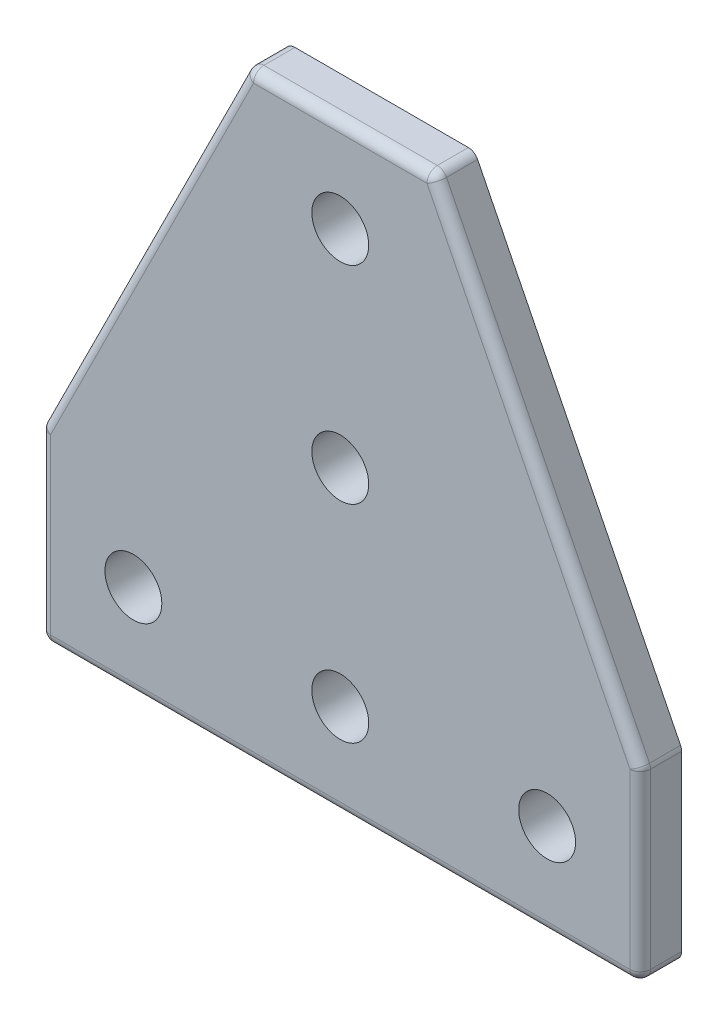
from build123d import *

# Parameters (mm, degrees)
SKETCH1_R           = 2.75
BOSS_EXTRUDE1_DEPTH = 2
FILLET1_R           = 1


with BuildPart() as part:
    # Sketch1 → Boss-Extrude1 (new, symmetric)
    with BuildSketch(Plane.XY):
        Polygon((0, 0), (0, 18), (20, 58), (38, 58), (58, 18), (58, 0), align=None)
        with Locations((9, 9)):
            Circle(SKETCH1_R, mode=Mode.SUBTRACT)
        with Locations((29, 9)):
            Circle(SKETCH1_R, mode=Mode.SUBTRACT)
        with Locations((49, 9)):
            Circle(SKETCH1_R, mode=Mode.SUBTRACT)
        with Locations((29, 29)):
            Circle(SKETCH1_R, mode=Mode.SUBTRACT)
        with Locations((29, 49)):
            Circle(SKETCH1_R, mode=Mode.SUBTRACT)
    extrude(amount=BOSS_EXTRUDE1_DEPTH, both=True)

    # Fillet1
    fillet1_edges = [part.edges().sort_by_distance(p)[0] for p in [
        (0, 0, 0),
        (0, 9, 2),
        (29, 0, 2),
        (58, 9, 2),
        (58, 0, 0),
        (29, 58, 2),
        (48, 38, 2),
        (58, 18, 0),
        (38, 58, 0),
        (10, 38, 2),
        (20, 58, 0),
        (0, 18, 0),
    ]]
    fillet(fillet1_edges, radius=FILLET1_R)


solid = part.part
